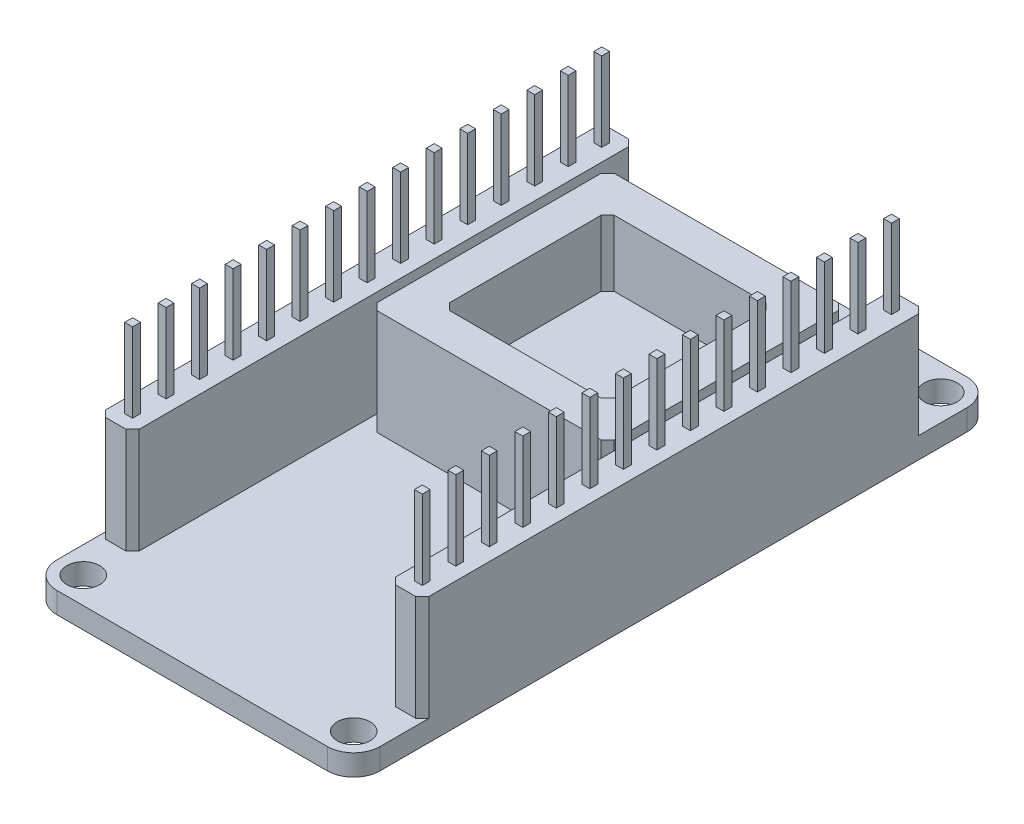
from build123d import *

# Parameters (mm, degrees)
SKETCH_1_R          = 1.25
EXTRUDE_1_DEPTH     = 1.6
SKETCH_2_W          = 18
SKETCH_2_H          = 18
SKETCH_2_W_2        = 2.54
SKETCH_2_H_2        = 38.1
EXTRUDE_2_DEPTH     = 8
SKETCH_4_W          = 12.5
SKETCH_4_H          = 12.5
CUT_EXTRUDE_1_DEPTH = 5
SKETCH_5_W          = 0.6
SKETCH_5_H          = 0.6
EXTRUDE_3_DEPTH     = 6
CHAMFER_1_SIZE      = 0.5


with BuildPart() as part:
    # 草图1 → 凸台-拉伸1 (new body)
    with BuildSketch(Plane(origin=(0, 0, 0), x_dir=(1, 0, 0), z_dir=(0, 1, 0))):
        with BuildLine():
            Line((-10.25, -24.25), (10.25, -24.25))
            ThreePointArc((10.25, -24.25), (11.664213562, -23.664213562), (12.25, -22.25))
            Line((12.25, -22.25), (12.25, 22.25))
            ThreePointArc((12.25, 22.25), (11.664213562, 23.664213562), (10.25, 24.25))
            Line((10.25, 24.25), (-10.25, 24.25))
            ThreePointArc((-10.25, 24.25), (-11.664213562, 23.664213562), (-12.25, 22.25))
            Line((-12.25, 22.25), (-12.25, -22.25))
            ThreePointArc((-12.25, -22.25), (-11.664213562, -23.664213562), (-10.25, -24.25))
        make_face()
        with Locations(Location((-10.25, 22.25, 0), (0, 0, 270))):
            Circle(SKETCH_1_R, mode=Mode.SUBTRACT)
        with Locations(Location((10.25, 22.25, 0), (0, 0, 270))):
            Circle(SKETCH_1_R, mode=Mode.SUBTRACT)
        with Locations(Location((-10.25, -22.25, 0), (0, 0, 270))):
            Circle(SKETCH_1_R, mode=Mode.SUBTRACT)
        with Locations(Location((10.25, -22.25, 0), (0, 0, 270))):
            Circle(SKETCH_1_R, mode=Mode.SUBTRACT)
    extrude(amount=EXTRUDE_1_DEPTH)

    # 草图2 → 凸台-拉伸2 (add)
    with BuildSketch(Plane(origin=(0, 1.6, 0), x_dir=(1, 0, 0), z_dir=(0, 1, 0))):
        with Locations((0, 7.25)):
            Rectangle(SKETCH_2_W, SKETCH_2_H)
        with Locations((-10.98, 0)):
            Rectangle(SKETCH_2_W_2, SKETCH_2_H_2)
        with Locations((10.98, 0)):
            Rectangle(SKETCH_2_W_2, SKETCH_2_H_2)
    extrude(amount=EXTRUDE_2_DEPTH)

    # 草图4 → 切除-拉伸1 (cut)
    with BuildSketch(Plane(origin=(0, 9.6, 0), x_dir=(1, 0, 0), z_dir=(0, 1, 0))):
        with Locations((0, 7.25)):
            Rectangle(SKETCH_4_W, SKETCH_4_H)
    extrude(amount=-CUT_EXTRUDE_1_DEPTH, mode=Mode.SUBTRACT)

    # 草图5 → 凸台-拉伸3 (add)
    with BuildSketch(Plane(origin=(0, 9.6, 0), x_dir=(1, 0, 0), z_dir=(0, 1, 0))):
        with Locations((-10.98, 17.78)):
            Rectangle(SKETCH_5_W, SKETCH_5_H)
        with Locations((-10.98, 15.24)):
            Rectangle(SKETCH_5_W, SKETCH_5_H)
        with Locations((-10.98, 12.7)):
            Rectangle(SKETCH_5_W, SKETCH_5_H)
        with Locations((-10.98, 10.16)):
            Rectangle(SKETCH_5_W, SKETCH_5_H)
        with Locations((-10.98, 7.62)):
            Rectangle(SKETCH_5_W, SKETCH_5_H)
        with Locations((-10.98, 5.08)):
            Rectangle(SKETCH_5_W, SKETCH_5_H)
        with Locations((-10.98, 2.54)):
            Rectangle(SKETCH_5_W, SKETCH_5_H)
        with Locations((-10.98, 0)):
            Rectangle(SKETCH_5_W, SKETCH_5_H)
        with Locations((-10.98, -2.54)):
            Rectangle(SKETCH_5_W, SKETCH_5_H)
        with Locations((-10.98, -5.08)):
            Rectangle(SKETCH_5_W, SKETCH_5_H)
        with Locations((-10.98, -7.62)):
            Rectangle(SKETCH_5_W, SKETCH_5_H)
        with Locations((-10.98, -10.16)):
            Rectangle(SKETCH_5_W, SKETCH_5_H)
        with Locations((-10.98, -12.7)):
            Rectangle(SKETCH_5_W, SKETCH_5_H)
        with Locations((-10.98, -15.24)):
            Rectangle(SKETCH_5_W, SKETCH_5_H)
        with Locations((-10.98, -17.78)):
            Rectangle(SKETCH_5_W, SKETCH_5_H)
        with Locations((10.98, -17.78)):
            Rectangle(SKETCH_5_W, SKETCH_5_H)
        with Locations((10.98, -15.24)):
            Rectangle(SKETCH_5_W, SKETCH_5_H)
        with Locations((10.98, -12.7)):
            Rectangle(SKETCH_5_W, SKETCH_5_H)
        with Locations((10.98, -10.16)):
            Rectangle(SKETCH_5_W, SKETCH_5_H)
        with Locations((10.98, -7.62)):
            Rectangle(SKETCH_5_W, SKETCH_5_H)
        with Locations((10.98, -5.08)):
            Rectangle(SKETCH_5_W, SKETCH_5_H)
        with Locations((10.98, -2.54)):
            Rectangle(SKETCH_5_W, SKETCH_5_H)
        with Locations((10.98, 0)):
            Rectangle(SKETCH_5_W, SKETCH_5_H)
        with Locations((10.98, 2.54)):
            Rectangle(SKETCH_5_W, SKETCH_5_H)
        with Locations((10.98, 5.08)):
            Rectangle(SKETCH_5_W, SKETCH_5_H)
        with Locations((10.98, 7.62)):
            Rectangle(SKETCH_5_W, SKETCH_5_H)
        with Locations((10.98, 10.16)):
            Rectangle(SKETCH_5_W, SKETCH_5_H)
        with Locations((10.98, 12.7)):
            Rectangle(SKETCH_5_W, SKETCH_5_H)
        with Locations((10.98, 15.24)):
            Rectangle(SKETCH_5_W, SKETCH_5_H)
        with Locations((10.98, 17.78)):
            Rectangle(SKETCH_5_W, SKETCH_5_H)
    extrude(amount=EXTRUDE_3_DEPTH)

    # 倒角1
    chamfer_1_edges = [part.edges().sort_by_distance(p)[0] for p in [
        (9, 5.6, 1.75),
        (9, 5.6, -16.25),
        (-9, 5.6, -16.25),
        (-9, 5.6, 1.75),
        (-12.25, 5.6, -19.05),
        (-12.25, 5.6, 19.05),
        (-9.71, 5.6, 19.05),
        (-9.71, 5.6, -19.05),
        (12.25, 5.6, -19.05),
        (9.71, 5.6, -19.05),
        (9.71, 5.6, 19.05),
        (12.25, 5.6, 19.05),
        (6.25, 7.1, -13.5),
        (6.25, 7.1, -1),
        (-6.25, 7.1, -1),
        (-6.25, 7.1, -13.5),
    ]]
    chamfer(chamfer_1_edges, length=CHAMFER_1_SIZE)


solid = part.part
